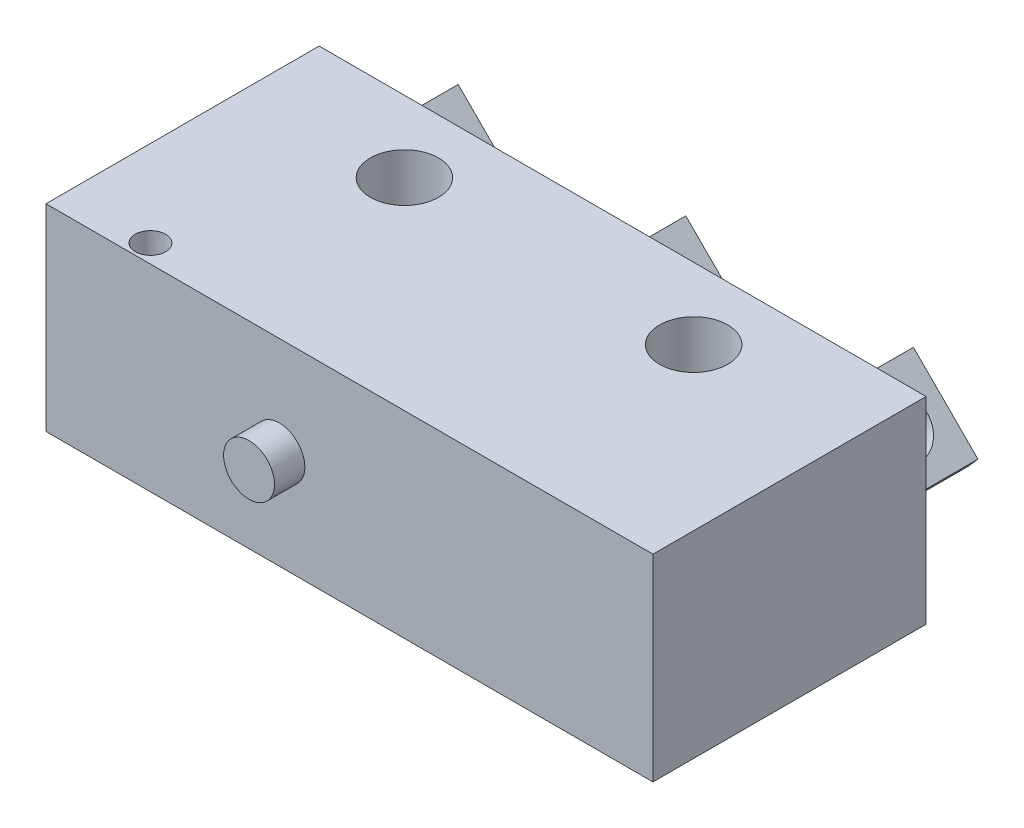
from build123d import *

# Parameters (mm, degrees)
SKETCH_1_W             = 20
SKETCH_1_H             = 6.5
EXTRUDE_1_DEPTH        = 9
HOLE_WIZARD_1_D        = 2.25
SKETCH_7_R             = 0.838393999
EXTRUDE_2_DEPTH        = 1
HOLE_WIZARD_2_D        = 1
EXTRUDE_3_DEPTH        = 3.2
HOLE_WIZARD_3_D        = 1.8
HOLE_WIZARD_3_DEPTH    = 6.5
PATTERN_LINEAR_1_COUNT = 3
PATTERN_LINEAR_1_PITCH = 7.5


with BuildPart() as part:
    # ｽｹｯﾁ1 → ﾎﾞｽ - 押し出し1 (new body)
    with BuildSketch(Plane.XY):
        Rectangle(SKETCH_1_W, SKETCH_1_H)
    extrude(amount=EXTRUDE_1_DEPTH)

    # 穴1 (through all)
    with Locations(Plane(origin=(0, -3.25, 0), x_dir=(-1, 0, 0), z_dir=(0, -1, 0))):
        with Locations((4.84, -2.35), (-4.69, -2.35)):
            Hole(HOLE_WIZARD_1_D / 2)

    # ｽｹｯﾁ7 → ﾎﾞｽ - 押し出し2 (add)
    with BuildSketch(Plane.XY.offset(9)):
        with Locations(Location((-2.31, 0, 0), (0, 0, 180))):
            Circle(SKETCH_7_R)
    extrude(amount=EXTRUDE_2_DEPTH)

    # 穴2 (through all)
    with Locations(Plane(origin=(0, -3.25, 0), x_dir=(-1, 0, 0), z_dir=(0, -1, 0))):
        with Locations((7.16, -8.4)):
            Hole(HOLE_WIZARD_2_D / 2)

    # ｽｹｯﾁ10 → ﾎﾞｽ - 押し出し3 (add)
    with BuildSketch(Plane(origin=(0, 0, 0), x_dir=(-1, 0, 0), z_dir=(0, 0, -1))):
        Polygon((-6.381555021, 1.244871931), (-8.509905901, -0.883478949), (-8.172897935, -1.265123133), (-6.058582994, 0.863179555), align=None)
    extrude_3 = extrude(amount=EXTRUDE_3_DEPTH)

    # 穴3
    with Locations(Plane(origin=(3.813213476, 3.813213476, 0), x_dir=(0, 0, -1), z_dir=(0.7071067811865488, 0.7071067811865462, 0))):
        with Locations((1.7, -5.132183446)):
            hole_wizard_3 = Hole(HOLE_WIZARD_3_D / 2, depth=HOLE_WIZARD_3_DEPTH)

    # 直線ﾊﾟﾀｰﾝ1: ﾎﾞｽ - 押し出し3, 穴3 ×3
    with Locations(*[(-i * PATTERN_LINEAR_1_PITCH, 0, 0) for i in range(1, PATTERN_LINEAR_1_COUNT)]):
        add(extrude_3)
        add(hole_wizard_3, mode=Mode.SUBTRACT)


solid = part.part
